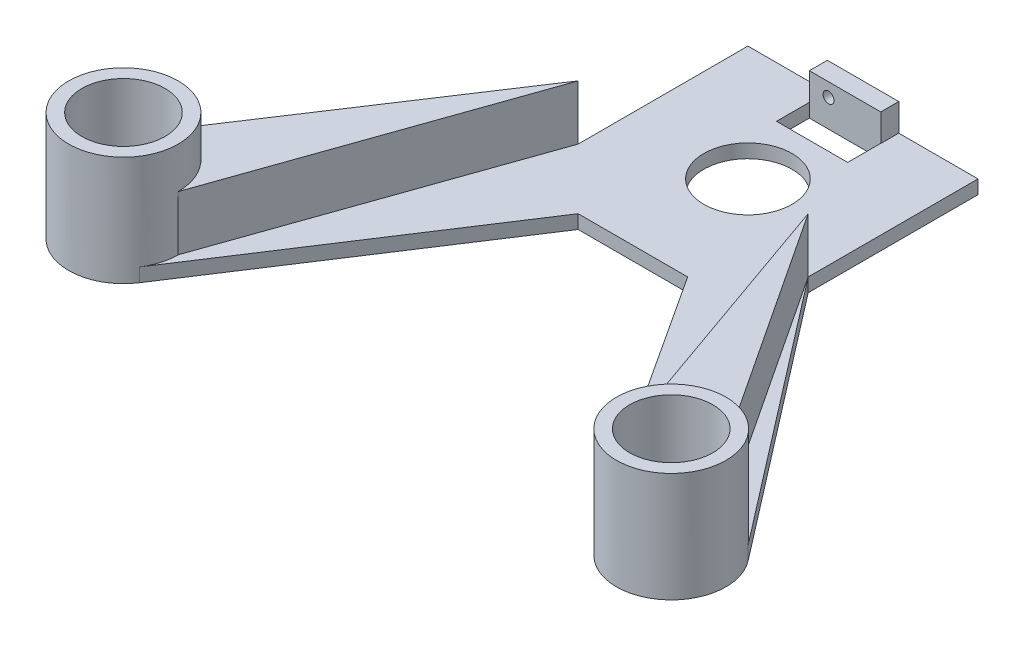
from build123d import *
from build123d.topology import SkipClean

# Parameters (mm, degrees)
SKETCH_6_W          = 42
SKETCH_6_H          = 42
SKETCH_6_R          = 8.05
EXTRUDE_1_DEPTH     = 2.5
SKETCH_7_R          = 4.05
EXTRUDE_5_DEPTH     = 2.5
EXTRUDE_START       = -20
SKETCH_9_R          = 10
SKETCH_9_R_2        = 7.6
EXTRUDE_7_DEPTH     = 20
EXTRUDE_START_2     = 10
EXTRUDE_8_DEPTH     = 10
SKETCH_11_W         = 13
SKETCH_11_H         = 6
CUT_EXTRUDE_1_DEPTH = 10
SKETCH_12_W         = 13.033140157
SKETCH_12_H         = 3.285057939
EXTRUDE_9_DEPTH     = 5
SKETCH_13_R         = 1
CUT_EXTRUDE_2_DEPTH = 10


with BuildPart() as part:
    # 草图6 → 凸台-拉伸1 (new body)
    with BuildSketch(Plane(origin=(0, 0, 0), x_dir=(1, 0, 0), z_dir=(0, 1, 0))):
        Rectangle(SKETCH_6_W, SKETCH_6_H)
        with Locations(Location((0, 0, 0), (0, 0, 270))):
            Circle(SKETCH_6_R, mode=Mode.SUBTRACT)
    extrude(amount=EXTRUDE_1_DEPTH)

    # 草图7 → 凸台-拉伸5 (add)
    # profile 1 of 2: a face of its own
    with BuildSketch(Plane(origin=(0, 2.5, 0), x_dir=(1, 0, 0), z_dir=(0, 1, 0))):
        with BuildLine():
            Line((-21, -21), (-21, -10))
            Line((-21, -10), (-57.920014013, -57.894807289))
            ThreePointArc((-57.920014013, -57.894807289), (-55.789479543, -72.15364499), (-41.625301702, -69.464835626))
            Line((-41.625301702, -69.464835626), (-10, -21))
            Line((-10, -21), (-21, -21))
        make_face()
        with Locations(Location((-50, -64, 0), (0, 0, 270))):
            Circle(SKETCH_7_R, mode=Mode.SUBTRACT)
    # profile 2 of 2: a face of its own
    with BuildSketch(Plane(origin=(0, 2.5, 0), x_dir=(1, 0, 0), z_dir=(0, 1, 0))):
        with BuildLine():
            Line((57.920014013, -57.894807289), (21, -10))
            Line((21, -10), (21, -21))
            Line((21, -21), (10, -21))
            Line((10, -21), (41.625301702, -69.464835626))
            ThreePointArc((41.625301702, -69.464835626), (55.789479543, -72.15364499), (57.920014013, -57.894807289))
        make_face()
        with Locations(Location((50, -64, 0), (0, 0, 270))):
            Circle(SKETCH_7_R, mode=Mode.SUBTRACT)
    extrude(amount=-EXTRUDE_5_DEPTH)

    # 草图9 → 凸台-拉伸7 (add)
    # profile 1 of 2: a face of its own
    with SkipClean():  # the faces are left unmerged after this step: merging them gives an invalid solid
        with BuildSketch(Plane(origin=(0, 0, 0), x_dir=(-1, 0, 0), z_dir=(0, -1, 0)).offset(EXTRUDE_START)):
            with Locations(Location((50, -64, 0), (0, 0, 213.126103521))):
                Circle(SKETCH_9_R)
            with Locations(Location((50, -64, 0), (0, 0, 90))):
                Circle(SKETCH_9_R_2, mode=Mode.SUBTRACT)
        # profile 2 of 2: a face of its own
        with BuildSketch(Plane(origin=(0, 0, 0), x_dir=(-1, 0, 0), z_dir=(0, -1, 0)).offset(EXTRUDE_START)):
            with Locations(Location((-50, -64, 0), (0, 0, 326.873896479))):
                Circle(SKETCH_9_R)
            with Locations(Location((-50, -64, 0), (0, 0, 90))):
                Circle(SKETCH_9_R_2, mode=Mode.SUBTRACT)
        extrude(amount=EXTRUDE_7_DEPTH)

    # 草图10 → 凸台-拉伸8 (add)
    with SkipClean():  # the faces are left unmerged after this step: merging them gives an invalid solid
        with BuildSketch(Plane(origin=(0, 2.5, 0), x_dir=(1, 0, 0), z_dir=(0, 1, 0)).offset(EXTRUDE_START_2)):
            with BuildLine():
                Line((-50, -54), (-21, -10))
                Line((-21, -10), (-40, -64))
                ThreePointArc((-40, -64), (-42.928932188, -56.928932188), (-50, -54))
            make_face()
            with BuildLine():
                Line((21, -10), (40, -64))
                ThreePointArc((40, -64), (42.928932188, -56.928932188), (50, -54))
                Line((50, -54), (21, -10))
            make_face()
        extrude(amount=-EXTRUDE_8_DEPTH)

    # 草图11 → 切除-拉伸1 (cut)
    with SkipClean():  # the faces are left unmerged after this step: merging them gives an invalid solid
        with BuildSketch(Plane(origin=(0, 0, 0), x_dir=(-1, 0, 0), z_dir=(0, -1, 0))):
            with Locations((0, 14.714942061)):
                Rectangle(SKETCH_11_W, SKETCH_11_H)
        extrude(amount=-CUT_EXTRUDE_1_DEPTH, mode=Mode.SUBTRACT)

    # 草图12 → 凸台-拉伸9 (add)
    with SkipClean():  # the faces are left unmerged after this step: merging them gives an invalid solid
        with BuildSketch(Plane(origin=(0, 2.5, 0), x_dir=(1, 0, 0), z_dir=(0, 1, 0))):
            with Locations((0.016570079, 19.357471031)):
                Rectangle(SKETCH_12_W, SKETCH_12_H)
        extrude(amount=EXTRUDE_9_DEPTH)

    # 草图13 → 切除-拉伸2 (cut)
    with SkipClean():  # the faces are left unmerged after this step: merging them gives an invalid solid
        with BuildSketch(Plane.XY.offset(-17.714942061)):
            with Locations((-2.99582225, 5.023747012)):
                Circle(SKETCH_13_R)
        extrude(amount=-CUT_EXTRUDE_2_DEPTH, mode=Mode.SUBTRACT)


solid = part.part
